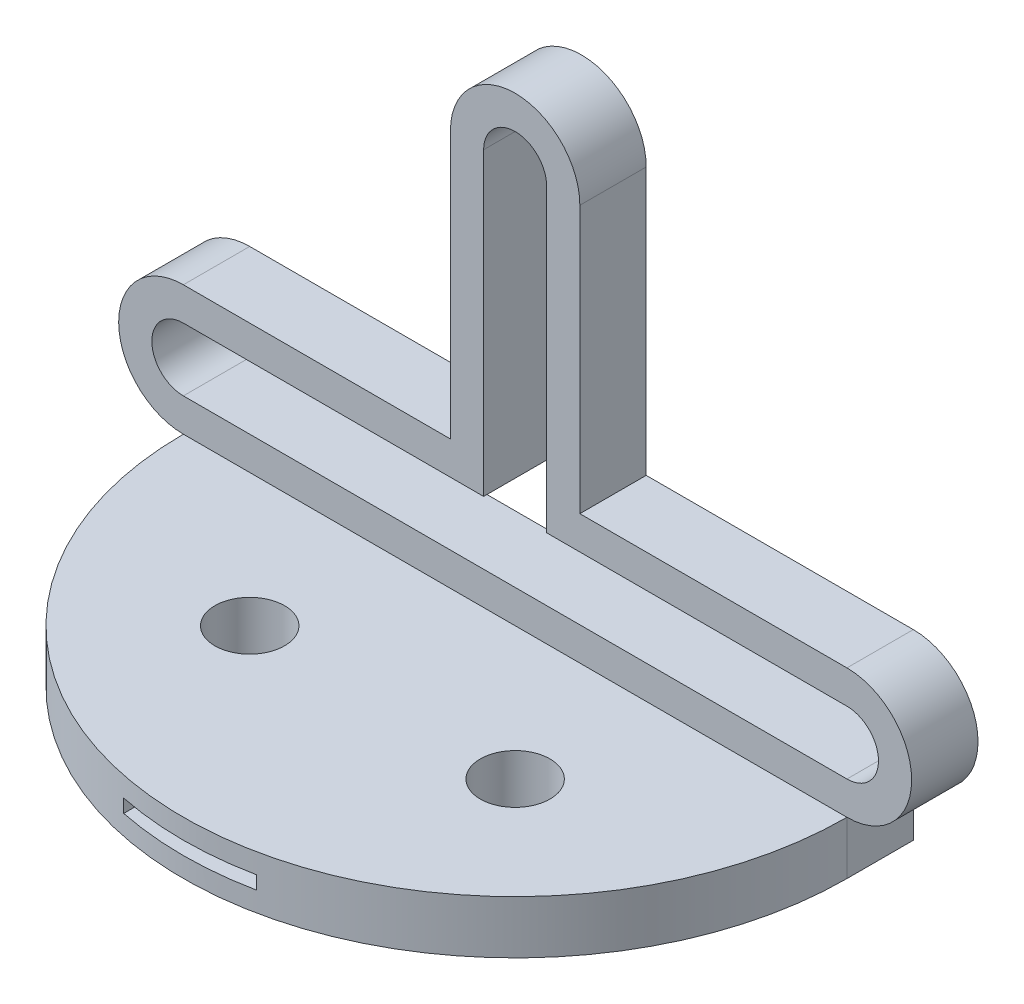
from build123d import *

# Parameters (mm, degrees)
SKETCH1_W           = 100
SKETCH1_H           = 8
BOSS_EXTRUDE1_DEPTH = 10
BOSS_EXTRUDE2_DEPTH = 8
SKETCH3_R           = 5.25
CUT_EXTRUDE1_DEPTH  = 105.404561682
SKETCH4_W           = 20
SKETCH4_H           = 2
CUT_EXTRUDE2_DEPTH  = 104.634574347
SKETCH5_R           = 10
CUT_EXTRUDE3_DEPTH  = 3


with BuildPart() as part:
    # Sketch1 → Boss-Extrude1 (new body)
    # profile 1 of 2: a face of its own
    with BuildSketch(Plane.XY):
        with BuildLine():
            ThreePointArc((-9.75, 50), (0, 59.75), (9.75, 50))
            Line((9.75, 50), (9.75, 9.75))
            Line((9.75, 9.75), (50, 9.75))
            ThreePointArc((50, 9.75), (59.75, 0), (50, -9.75))
            Line((50, -9.75), (-50, -9.75))
            ThreePointArc((-50, -9.75), (-59.75, 0), (-50, 9.75))
            Line((-50, 9.75), (-9.75, 9.75))
            Line((-9.75, 9.75), (-9.75, 50))
        make_face()
        with BuildLine():
            Line((4.75, 4.75), (50, 4.75))
            ThreePointArc((50, 4.75), (54.75, 0), (50, -4.75))
            Line((50, -4.75), (-50, -4.75))
            ThreePointArc((-50, -4.75), (-54.75, 0), (-50, 4.75))
            Line((-50, 4.75), (-4.75, 4.75))
            Line((-4.75, 4.75), (-4.75, 50))
            ThreePointArc((-4.75, 50), (0, 54.75), (4.75, 50))
            Line((4.75, 50), (4.75, 4.75))
        make_face(mode=Mode.SUBTRACT)
    # profile 2 of 2: a face of its own
    with BuildSketch(Plane.XY):
        with Locations((0, -13.75)):
            Rectangle(SKETCH1_W, SKETCH1_H)
    extrude(amount=-BOSS_EXTRUDE1_DEPTH)

    # Sketch2 → Boss-Extrude2 (add)
    with BuildSketch(Plane.XZ.offset(17.75)):
        with BuildLine():
            Line((-50, 0), (50, 0))
            ThreePointArc((50, 0), (0, 50), (-50, 0))
        make_face()
    extrude(amount=-BOSS_EXTRUDE2_DEPTH)

    # Sketch3 → Cut-Extrude1 (cut, through all)
    with BuildSketch(Plane(origin=(0, -9.75, 0), x_dir=(1, 0, 0), z_dir=(0, 1, 0))):
        with Locations(Location((20, -20, 0), (0, 0, 270))):
            Circle(SKETCH3_R)
        with Locations(Location((-20, -20, 0), (0, 0, 270))):
            Circle(SKETCH3_R)
    extrude(amount=-CUT_EXTRUDE1_DEPTH, mode=Mode.SUBTRACT)

    # Sketch4 → Cut-Extrude2 (cut, through all)
    with BuildSketch(Plane(origin=(0, 0, -10), x_dir=(-1, 0, 0), z_dir=(0, 0, -1))):
        with Locations((0, -13.75)):
            Rectangle(SKETCH4_W, SKETCH4_H)
    extrude(amount=-CUT_EXTRUDE2_DEPTH, mode=Mode.SUBTRACT)

    # Sketch5 → Cut-Extrude3 (cut)
    with BuildSketch(Plane.XZ.offset(17.75)):
        with Locations(Location((0, 20, 0), (0, 0, 270))):
            Circle(SKETCH5_R)
    extrude(amount=-CUT_EXTRUDE3_DEPTH, mode=Mode.SUBTRACT)


solid = part.part
